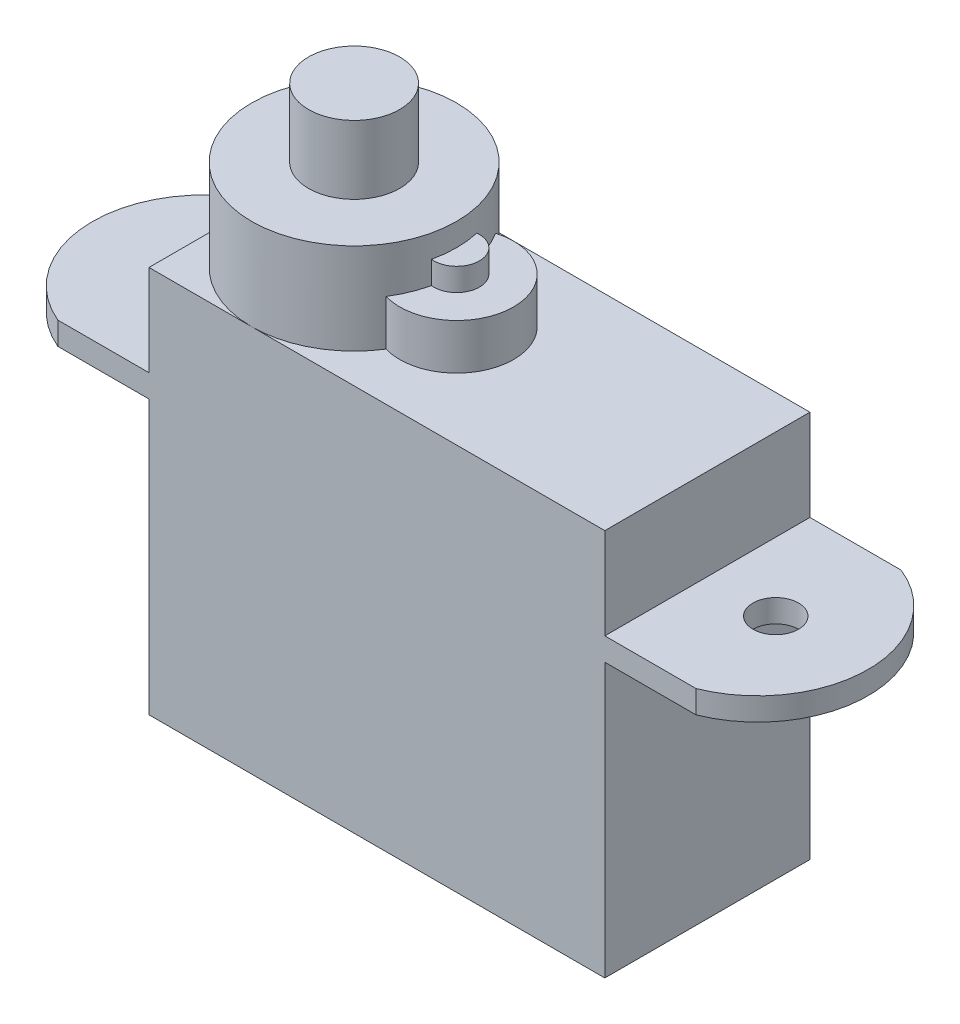
from build123d import *

# Parameters (mm, degrees)
BOSS_EXTRUDE3_DEPTH      = 4
BOSS_EXTRUDE3_DEPTH_BACK = 13
SKETCH1_W                = 20
SKETCH1_H                = 9
BOSS_EXTRUDE4_DEPTH      = 0.0001
BOSS_EXTRUDE4_DEPTH_BACK = 1
SKETCH1_3_R              = 1
SKETCH1_8_R              = 1
BOSS_EXTRUDE6_DEPTH      = 7
SKETCH1_9_R              = 2
BOSS_EXTRUDE7_DEPTH      = 11
SKETCH1_11_R             = 4.5
BOSS_EXTRUDE10_DEPTH     = 8
SKETCH1_12_R             = 2.5
BOSS_EXTRUDE11_DEPTH     = 6


with BuildPart() as part:
    # Sketch1 → Boss-Extrude3 (new, two sides: drawn at the far end of the back side and taken through both)
    with BuildSketch(Plane(origin=(0, 0, 0), x_dir=(1, 0, 0), z_dir=(0, 1, 0)).offset(-BOSS_EXTRUDE3_DEPTH_BACK)):
        Rectangle(SKETCH1_W, SKETCH1_H)
    extrude(amount=BOSS_EXTRUDE3_DEPTH + BOSS_EXTRUDE3_DEPTH_BACK)

    # Sketch1<3> → Boss-Extrude4 (add, two sides: drawn at the far end of the back side and taken through both)
    # profile 1 of 2: a face of its own
    with BuildSketch(Plane(origin=(0, 0, 0), x_dir=(1, 0, 0), z_dir=(0, 1, 0)).offset(-BOSS_EXTRUDE4_DEPTH_BACK)):
        with BuildLine():
            Line((-14, -4.5), (-10, -4.5))
            Line((-10, -4.5), (-10, 4.5))
            Line((-10, 4.5), (-14, 4.5))
            ThreePointArc((-14, 4.5), (-16.985823737, 0), (-14, -4.5))
        make_face()
        with Locations((-13, 0)):
            Circle(SKETCH1_3_R, mode=Mode.SUBTRACT)
    # profile 2 of 2: a face of its own
    with BuildSketch(Plane(origin=(0, 0, 0), x_dir=(1, 0, 0), z_dir=(0, 1, 0)).offset(-BOSS_EXTRUDE4_DEPTH_BACK)):
        with BuildLine():
            Line((10, 4.5), (10, -4.5))
            Line((10, -4.5), (14, -4.5))
            ThreePointArc((14, -4.5), (17.054182563, 0), (14, 4.5))
            Line((14, 4.5), (10, 4.5))
        make_face()
        with Locations((13, 0)):
            Circle(SKETCH1_3_R, mode=Mode.SUBTRACT)
    extrude(amount=BOSS_EXTRUDE4_DEPTH + BOSS_EXTRUDE4_DEPTH_BACK)

    # Sketch1<8> → Boss-Extrude6 (add)
    with BuildSketch(Plane(origin=(0, 0, 0), x_dir=(1, 0, 0), z_dir=(0, 1, 0))):
        with Locations((-1, 0)):
            Circle(SKETCH1_8_R)
    extrude(amount=BOSS_EXTRUDE6_DEPTH)

    # Sketch1<9> → Boss-Extrude7 (add)
    with BuildSketch(Plane(origin=(0, 0, 0), x_dir=(1, 0, 0), z_dir=(0, 1, 0))):
        with Locations((-5.5, 0)):
            Circle(SKETCH1_9_R)
    extrude(amount=BOSS_EXTRUDE7_DEPTH)

    # Sketch1<11> → Boss-Extrude10 (add)
    with BuildSketch(Plane(origin=(0, 0, 0), x_dir=(1, 0, 0), z_dir=(0, 1, 0))):
        with Locations((-5.5, 0)):
            Circle(SKETCH1_11_R)
    extrude(amount=BOSS_EXTRUDE10_DEPTH)

    # Sketch1<12> → Boss-Extrude11 (add)
    with BuildSketch(Plane(origin=(0, 0, 0), x_dir=(1, 0, 0), z_dir=(0, 1, 0))):
        with Locations((-1, 0)):
            Circle(SKETCH1_12_R)
    extrude(amount=BOSS_EXTRUDE11_DEPTH)


solid = part.part
